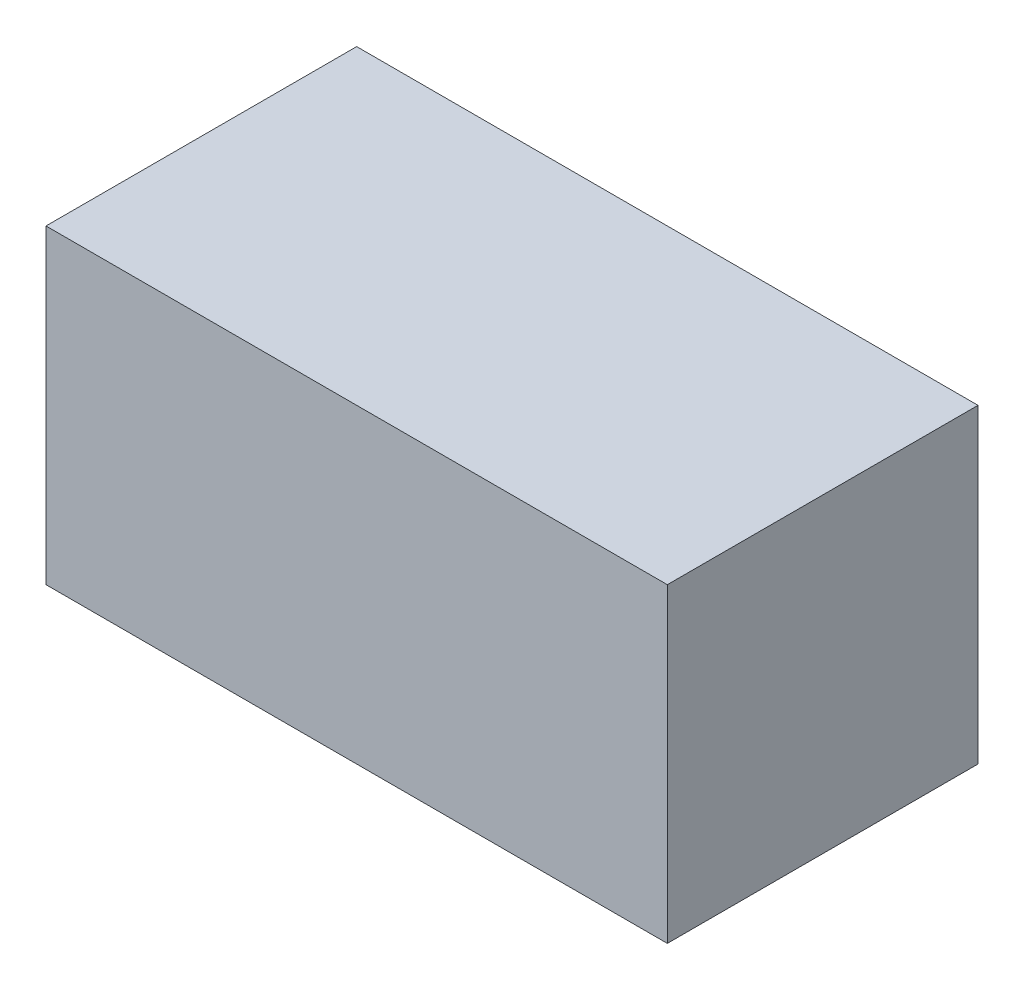
from build123d import *

# Parameters (mm, degrees)
SKETCH1_W           = 100
SKETCH1_H           = 50
BOSS_EXTRUDE1_DEPTH = 50


with BuildPart() as part:
    # Sketch1 → Boss-Extrude1 (new body)
    with BuildSketch(Plane(origin=(0, 0, 0), x_dir=(1, 0, 0), z_dir=(0, 1, 0))):
        with Locations((50, 25)):
            Rectangle(SKETCH1_W, SKETCH1_H)
    extrude(amount=BOSS_EXTRUDE1_DEPTH)


solid = part.part
